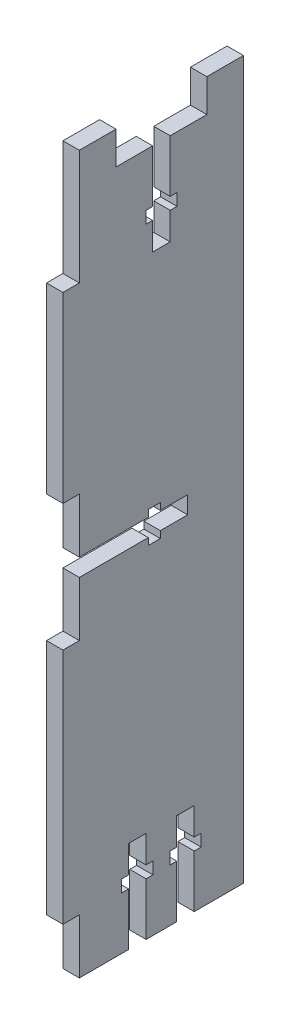
from build123d import *

# Parameters (mm, degrees)
BOSS_EXTRUDE1_DEPTH = 3


with BuildPart() as part:
    # Sketch1 → Boss-Extrude1 (new body)
    with BuildSketch(Plane(origin=(0, 0, 0), x_dir=(0, 0, -1), z_dir=(1, 0, 0))):
        Polygon((-2.8, -60), (2.8, -60), (2.8, -50.4), (1.55, -50.4), (1.55, -48.2), (2.8, -48.2), (2.8, -43.2), (6, -43.2), (6, -48.2), (7.25, -48.2), (7.25, -50.4), (6, -50.4), (6, -60), (15, -60), (15, 60), (15, 71), (8.3, 71), (8.3, 65), (1.6, 65), (1.6, 55.4), (2.85, 55.4), (2.85, 53.2), (1.6, 53.2), (1.6, 48.2), (-1.6, 48.2), (-1.6, 53.2), (-2.85, 53.2), (-2.85, 55.4), (-1.6, 55.4), (-1.6, 65), (-8.3, 65), (-8.3, 71), (-15, 71), (-15, 60), (-15, 55), (-15, 50), (-18, 50), (-18, 16.6), (-15, 16.6), (-15, 6.6), (-2.4, 6.6), (-2.4, 7.85), (-0.2, 7.85), (-0.2, 6.6), (4.8, 6.6), (4.8, 3.4), (-0.2, 3.4), (-0.2, 2.15), (-2.4, 2.15), (-2.4, 3.4), (-15, 3.4), (-15, -6.6), (-18, -6.6), (-18, -50), (-15, -50), (-15, -60), (-6, -60), (-6, -50.4), (-7.25, -50.4), (-7.25, -48.2), (-6, -48.2), (-6, -43.2), (-2.8, -43.2), (-2.8, -48.2), (-1.55, -48.2), (-1.55, -50.4), (-2.8, -50.4), align=None)
    extrude(amount=BOSS_EXTRUDE1_DEPTH)


solid = part.part
